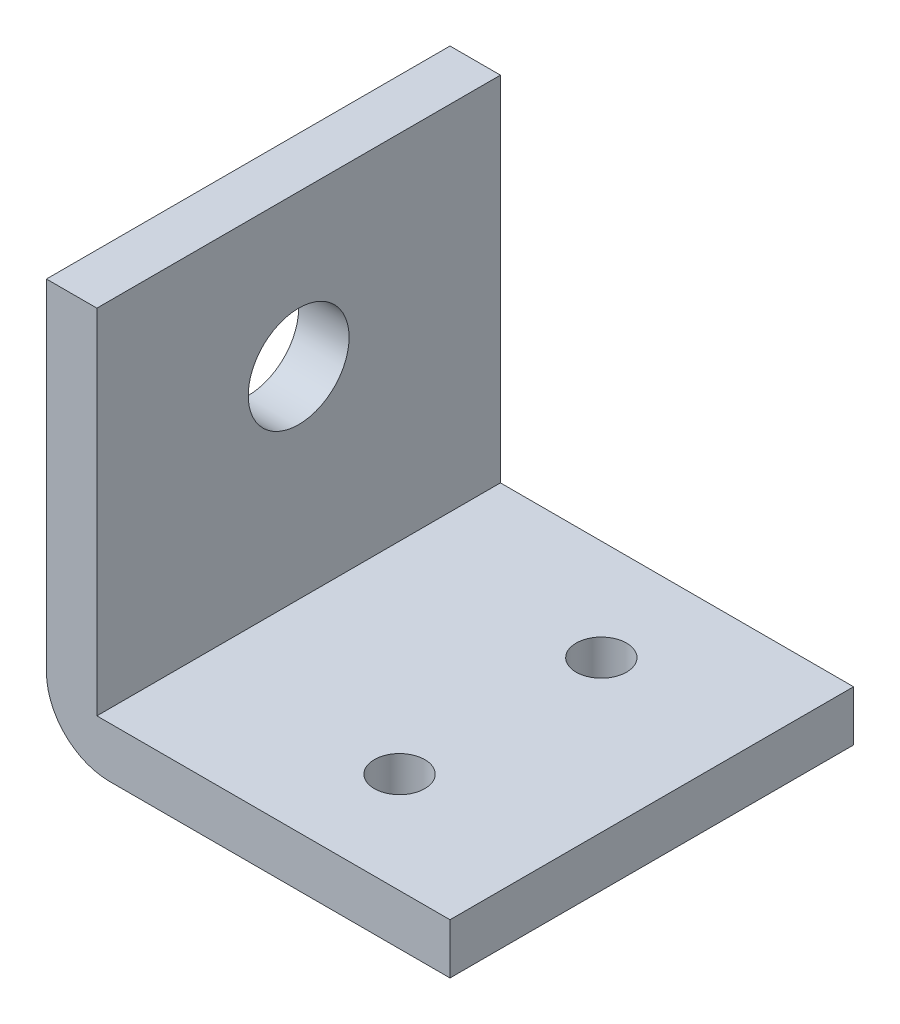
from build123d import *

# Parameters (mm, degrees)
BOSS_EXTRUDE3_DEPTH = 20
SKETCH4_R           = 2.5
CUT_EXTRUDE2_DEPTH  = 40
SKETCH5_R           = 5
CUT_EXTRUDE3_DEPTH  = 40


with BuildPart() as part:
    # Sketch1 → Boss-Extrude3 (new, symmetric)
    with BuildSketch(Plane.XY):
        with BuildLine():
            Line((0, 40), (0, 6.25))
            ThreePointArc((0, 6.25), (1.830582618, 1.830582618), (6.25, 0))
            Line((6.25, 0), (40, 0))
            Line((40, 0), (40, 5))
            Line((40, 5), (5, 5))
            Line((5, 5), (5, 40))
            Line((5, 40), (0, 40))
        make_face()
    extrude(amount=BOSS_EXTRUDE3_DEPTH, both=True)

    # Sketch4 → Cut-Extrude2 (cut)
    with BuildSketch(Plane(origin=(0, 5, 0), x_dir=(1, 0, 0), z_dir=(0, 1, 0))):
        with Locations(Location((25, -10, 0), (0, 0, 270))):
            Circle(SKETCH4_R)
        with Locations(Location((25, 10, 0), (0, 0, 270))):
            Circle(SKETCH4_R)
    extrude(amount=-CUT_EXTRUDE2_DEPTH, mode=Mode.SUBTRACT)

    # Sketch5 → Cut-Extrude3 (cut)
    with BuildSketch(Plane(origin=(5, 0, 0), x_dir=(0, 0, -1), z_dir=(1, 0, 0))):
        with Locations((0, 25)):
            Circle(SKETCH5_R)
    extrude(amount=-CUT_EXTRUDE3_DEPTH, mode=Mode.SUBTRACT)


solid = part.part
